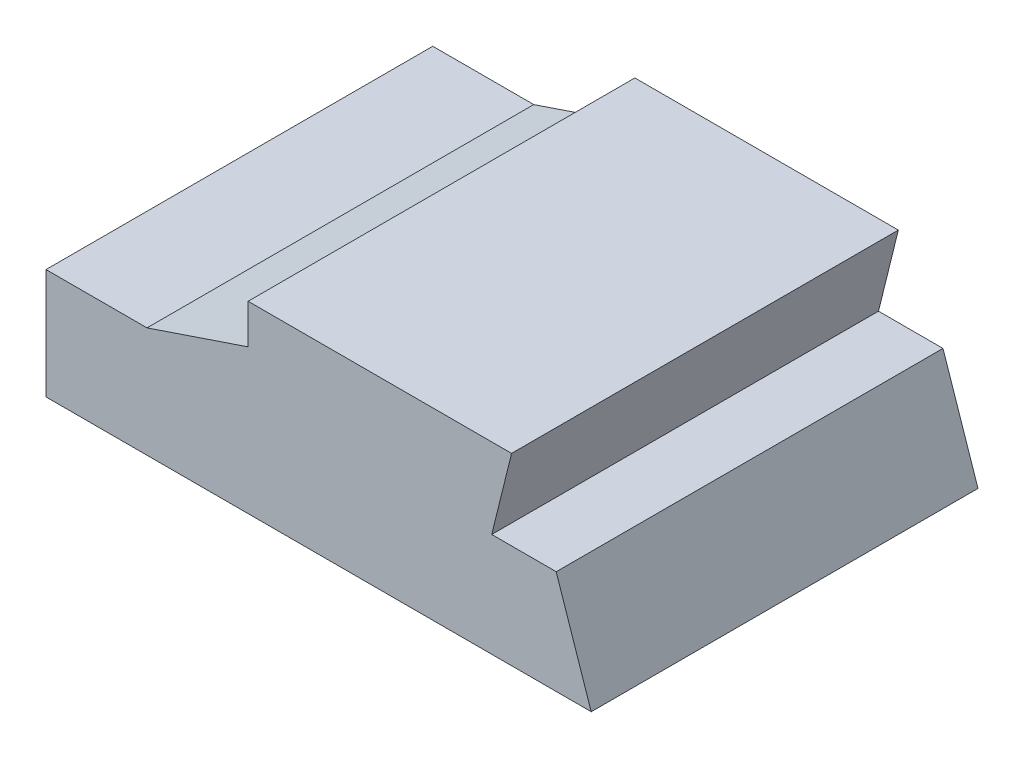
from build123d import *

# Parameters (mm, degrees)
EXTRUDE_1_DEPTH                = 50
SPLIT_BODIES_1_SURFACE_1_BACK  = 226.829
SPLIT_BODIES_1_SURFACE_1_DEPTH = 453.658
SPLIT_BODIES_1_SURFACE_2_BACK  = 226.829
SPLIT_BODIES_1_SURFACE_2_DEPTH = 453.658


with BuildPart() as part:
    # 草图2 → 凸台-拉伸1 (new, symmetric)
    with BuildSketch(Plane.XY):
        with BuildLine():
            Line((120.381757685, 47.561632043), (136.603924057, 47.561632043))
            Line((136.603924057, 47.561632043), (146.850265064, 88.947420909))
            ThreePointArc((146.850265064, 88.947420909), (104.62030332, 85.070472378), (109.988846824, 127.136838271))
            Line((109.988846824, 127.136838271), (88.280849451, 128.197534042))
            ThreePointArc((88.280849451, 128.197534042), (80.571822415, 123.964886157), (80.863683371, 115.175163571))
            ThreePointArc((80.863683371, 115.175163571), (88.300101913, 100.587398022), (92.288223879, 84.706651578))
            Line((92.288223879, 84.706651578), (52.259104564, 84.706651578))
            Line((52.259104564, 84.706651578), (52.259104564, 37.347972633))
            Line((52.259104564, 37.347972633), (26.12059868, 28.530814049))
            Line((26.12059868, 28.530814049), (0, 28.530814049))
            Line((0, 28.530814049), (0, 0))
            Line((0, 0), (140.98, 0))
            Line((140.98, 0), (131.928221984, 26.834036233))
            Line((131.928221984, 26.834036233), (115.249995775, 26.834036233))
            Line((115.249995775, 26.834036233), (120.381757685, 47.561632043))
        make_face()
        with BuildLine():
            ThreePointArc((109.988846824, 127.136838271), (104.62030332, 85.070472378), (146.850265064, 88.947420909))
            Line((146.850265064, 88.947420909), (151.231226865, 106.642475172))
            ThreePointArc((151.231226865, 106.642475172), (147.884639105, 117.258207331), (140.564064785, 125.64287253))
            Line((140.564064785, 125.64287253), (109.988846824, 127.136838271))
        make_face()
        with BuildLine():
            ThreePointArc((140.564064785, 125.64287253), (125.506724817, 131.102497099), (109.988846824, 127.136838271))
            Line((109.988846824, 127.136838271), (140.564064785, 125.64287253))
        make_face()
        with BuildLine():
            ThreePointArc((140.564064785, 125.64287253), (147.884639105, 117.258207331), (151.231226865, 106.642475172))
            Line((151.231226865, 106.642475172), (154.115877694, 118.293810031))
            ThreePointArc((154.115877694, 118.293810031), (153.172952645, 122.982290954), (148.95330104, 125.232957822))
            Line((148.95330104, 125.232957822), (140.564064785, 125.64287253))
        make_face()
    extrude(amount=EXTRUDE_1_DEPTH, both=True)


with BuildPart() as body_2:
    # Split Bodies 1: the piece behind the surface
    add(part.part)
    # Split Bodies 1 surface: a surface, the sketch's curves swept straight by 453.658 mm
    with BuildLine(Plane.XY.offset(50).offset(-SPLIT_BODIES_1_SURFACE_1_BACK), mode=Mode.PRIVATE) as split_bodies_1_surface_1_path:
        Line((120.381757685, 47.561632043), (52.259104564, 47.561632043))
    split_bodies_1_surface_1 = Shell.extrude(split_bodies_1_surface_1_path.wire(), (0 * SPLIT_BODIES_1_SURFACE_1_DEPTH, 0 * SPLIT_BODIES_1_SURFACE_1_DEPTH, 1 * SPLIT_BODIES_1_SURFACE_1_DEPTH))
    split(bisect_by=split_bodies_1_surface_1, keep=Keep.BOTTOM)


with BuildPart() as part_1:
    add(part.part)

    # Split Bodies 1: split by a surface, the side it looks to stays
    # Split Bodies 1 surface: a surface, the sketch's curves swept straight by 453.658 mm
    with BuildLine(Plane.XY.offset(50).offset(-SPLIT_BODIES_1_SURFACE_2_BACK), mode=Mode.PRIVATE) as split_bodies_1_surface_2_path:
        Line((120.381757685, 47.561632043), (52.259104564, 47.561632043))
    split_bodies_1_surface_2 = Shell.extrude(split_bodies_1_surface_2_path.wire(), (0 * SPLIT_BODIES_1_SURFACE_2_DEPTH, 0 * SPLIT_BODIES_1_SURFACE_2_DEPTH, 1 * SPLIT_BODIES_1_SURFACE_2_DEPTH))
    split(bisect_by=split_bodies_1_surface_2, keep=Keep.TOP)


solid = part_1.part
